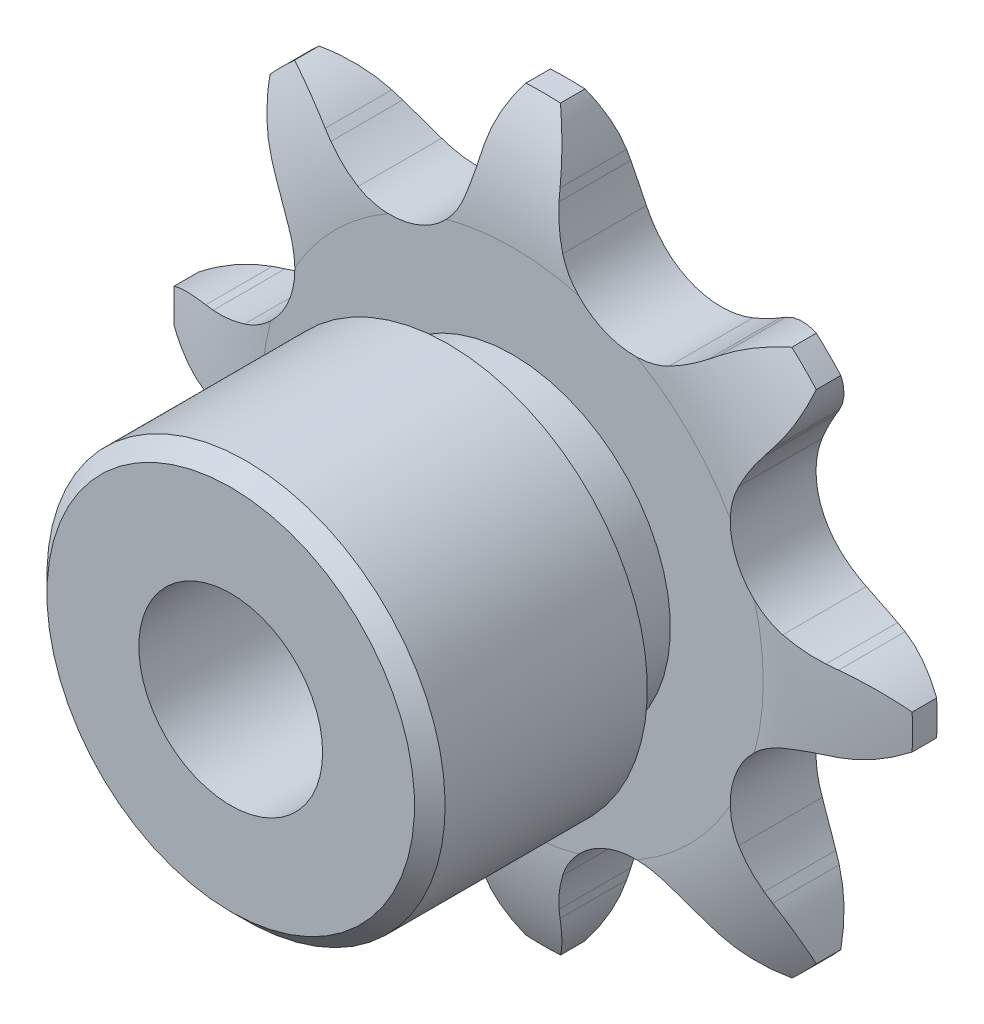
from build123d import *

# Parameters (mm, degrees)
CUT_EXTRUDE1_DEPTH      = 18.108345004
CIRPATTERN1_COUNT       = 8
BOSS_EXTRUDE1_START     = 1.4
SKETCH2_R               = 6.5
BOSS_EXTRUDE1_DEPTH     = 9.2
CUT_EXTRUDE2_DEPTH      = 21.077237699
CUT_EXTRUDE2_DEPTH_BACK = 21.077237699
SKETCH3_R               = 3
SKETCH4_W               = 2.1
SKETCH4_H               = 6.90435053


with BuildPart() as part:
    # Sketch1 → Revolve1 (revolve)
    with BuildSketch(Plane(origin=(0, 0, 0), x_dir=(0, 0, -1), z_dir=(1, 0, 0))):
        with BuildLine():
            Line((1.4, 0), (-1.4, 0))
            Line((-1.4, 0), (-1.4, 8.183870903))
            ThreePointArc((-1.4, 8.183870903), (-1.145966692, 10.183870903), (-0.4, 12.056854249))
            Line((-0.4, 12.056854249), (0.4, 12.056854249))
            ThreePointArc((0.4, 12.056854249), (1.145966692, 10.183870903), (1.4, 8.183870903))
            Line((1.4, 8.183870903), (1.4, 0))
        make_face()
    revolve(axis=Axis((0, 0, -1.4), (0, 0, 1)))

    # Sketch0 → Cut-Extrude1 (cut, symmetric)
    with BuildSketch(Plane.XY):
        with BuildLine():
            Line((6.428309132, -8.177568921), (6.159873027, -7.982538674))
            ThreePointArc((6.159873027, -7.982538674), (5.634207753, -7.637897419), (5.077930138, -7.345225608))
            ThreePointArc((5.077930138, -7.345225608), (3.023927637, -7.300407114), (1.603220001, -8.784497672))
            ThreePointArc((1.603220001, -8.784497672), (1.41682255, -9.384795568), (1.288819239, -10.000195216))
            Line((1.288819239, -10.000195216), (1.236913459, -10.327915416))
            ThreePointArc((1.236913459, -10.327915416), (-0.73498539, -13.299856797), (-4.272650045, -13.753452913))
            ThreePointArc((-4.272650045, -13.753452913), (5.511345697, -13.305565529), (12.74637964, -6.703939999))
            ThreePointArc((12.74637964, -6.703939999), (9.924132084, -8.884705777), (6.428309132, -8.177568921))
        make_face()
    cut_extrude1 = extrude(amount=CUT_EXTRUDE1_DEPTH, both=True, mode=Mode.SUBTRACT)

    # CirPattern1: Cut-Extrude1 ×8 about axis
    cirpattern1_axis = Axis((0, 0, 0), (0, 0, 1))
    for i in range(1, CIRPATTERN1_COUNT):
        add(cut_extrude1.rotate(cirpattern1_axis, i * 360 / CIRPATTERN1_COUNT), mode=Mode.SUBTRACT)

    # Sketch2 → Boss-Extrude1 (add)
    with BuildSketch(Plane.XY.offset(BOSS_EXTRUDE1_START)):
        with Locations(Location((0, 0, 0), (0, 0, 270))):
            Circle(SKETCH2_R)
    extrude(amount=BOSS_EXTRUDE1_DEPTH)

    # Sketch3 → Cut-Extrude2 (cut, two sides: drawn at the far end of the back side and taken through both)
    with BuildSketch(Plane.XY.offset(-CUT_EXTRUDE2_DEPTH_BACK)):
        Circle(SKETCH3_R)
    extrude(amount=CUT_EXTRUDE2_DEPTH + CUT_EXTRUDE2_DEPTH_BACK, mode=Mode.SUBTRACT)

    # Sketch4 → Cut-Revolve1 (revolve, cut)
    with BuildSketch(Plane(origin=(0, 0, 0), x_dir=(0, 0, -1), z_dir=(1, 0, 0))):
        Polygon((-10.6, 6.5), (-10.6, 6), (-10.1, 6.5), align=None)
        with Locations((-2.45, 8.604678984)):
            Rectangle(SKETCH4_W, SKETCH4_H)
    revolve(axis=Axis((0, 0, -1.4), (0, 0, 1)), mode=Mode.SUBTRACT)


solid = part.part
